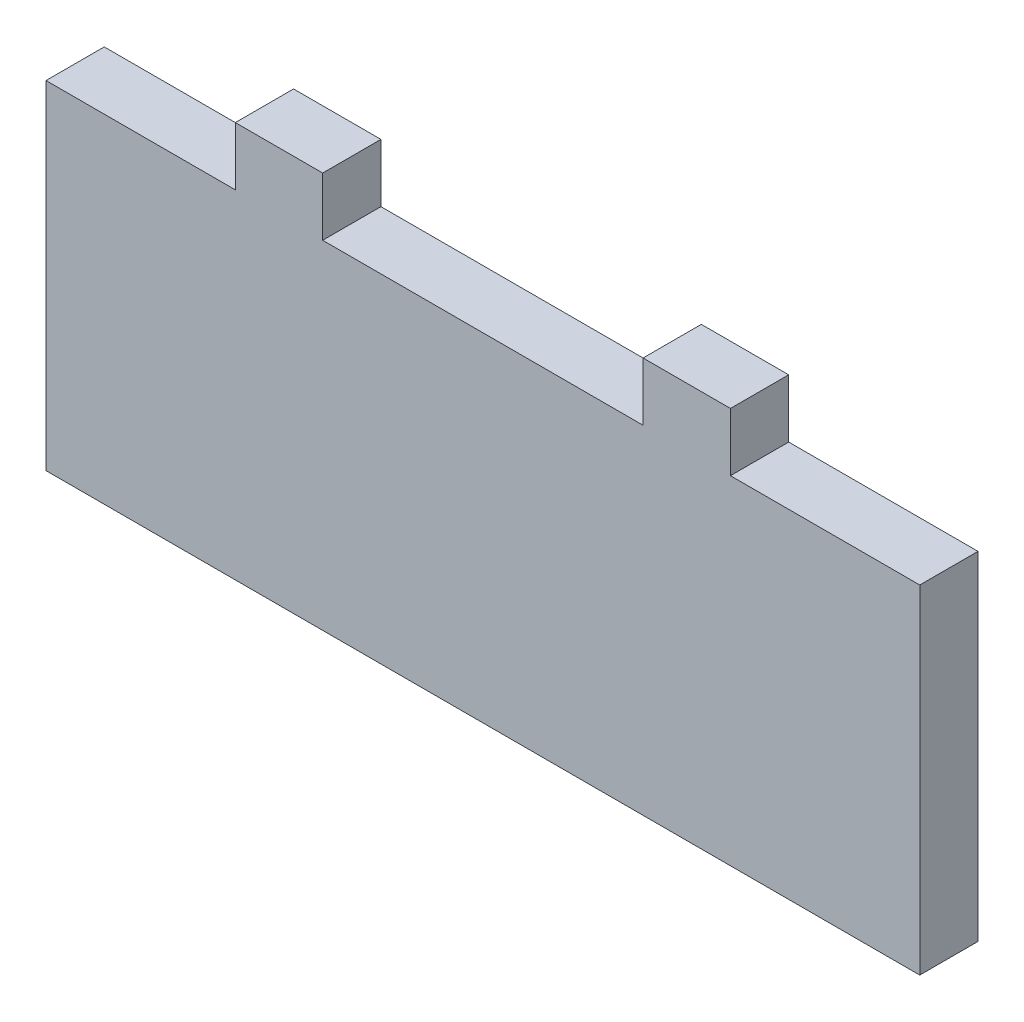
from build123d import *

# Parameters (mm, degrees)
EXTRUDE1_DEPTH = 12.7


with BuildPart() as part:
    # Sketch1 → Extrude1 (new body)
    with BuildSketch(Plane.XY):
        Polygon((-95.25, 215.9), (-53.975, 215.9), (-53.975, 228.6), (-34.925, 228.6), (-34.925, 215.9), (34.925, 215.9), (34.925, 228.6), (53.975, 228.6), (53.975, 215.9), (95.25, 215.9), (95.25, 142.24), (-95.25, 142.24), align=None)
    extrude(amount=-EXTRUDE1_DEPTH)


solid = part.part
